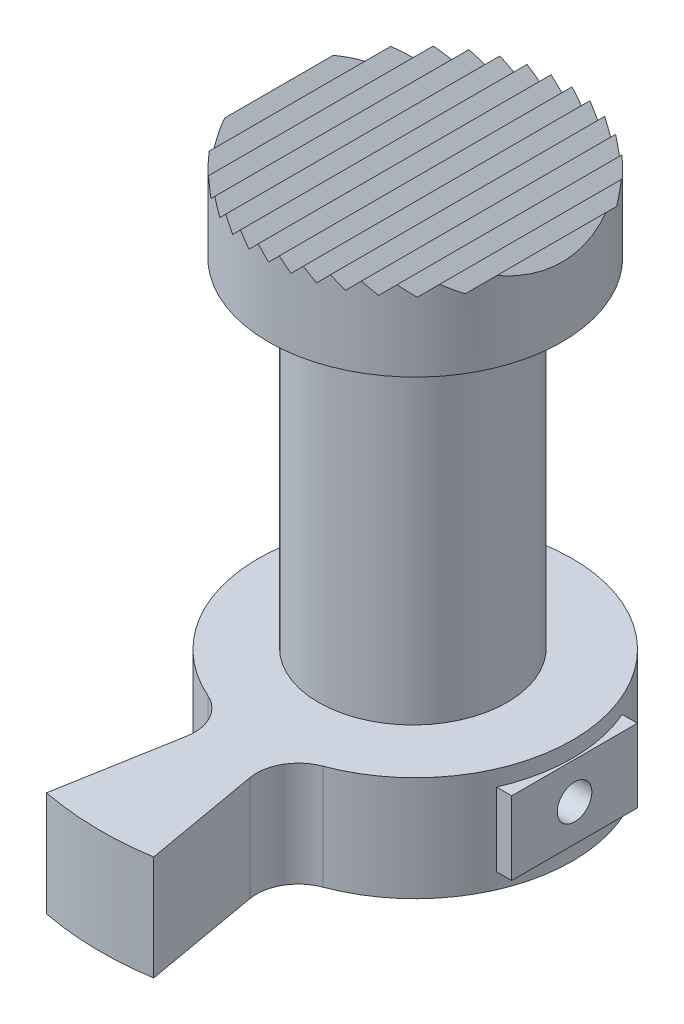
from build123d import *

# Parameters (mm, degrees)
SKETCH1_R                = 7.5
BOSS_EXTRUDE1_DEPTH      = 5
SKETCH2_R                = 7
BOSS_EXTRUDE2_DEPTH      = 20
CUT_EXTRUDE2_DEPTH       = 28.156951228
CUT_EXTRUDE2_DEPTH_BACK  = 28.156951228
SKETCH6_R                = 1.3
CUT_EXTRUDE3_DEPTH       = 0.7
SKETCH9_R                = 0.8
CUT_EXTRUDE4_DEPTH       = 7
BOSS_EXTRUDE3_DEPTH      = 0.1
BOSS_EXTRUDE3_DEPTH_BACK = 1
SKETCH10_W               = 6
SKETCH10_H               = 3.5
SKETCH17_R               = 7.5
SKETCH17_R_2             = 4.5
CUT_EXTRUDE7_DEPTH       = 16.2
BOSS_EXTRUDE6_DEPTH      = 5
FILLET2_R                = 2
SKETCH11_R               = 0.825
CUT_EXTRUDE8_DEPTH       = 7.5


with BuildPart() as part:
    # Sketch1 → Boss-Extrude1 (new body)
    with BuildSketch(Plane(origin=(0, 0, 0), x_dir=(1, 0, 0), z_dir=(0, 1, 0))):
        with Locations(Location((0, 0, 0), (0, 0, 270))):
            Circle(SKETCH1_R)
    extrude(amount=BOSS_EXTRUDE1_DEPTH)

    # Sketch2 → Boss-Extrude2 (add)
    with BuildSketch(Plane(origin=(0, 5, 0), x_dir=(1, 0, 0), z_dir=(0, 1, 0))):
        with Locations(Location((0, 0, 0), (0, 0, 270))):
            Circle(SKETCH2_R)
    extrude(amount=BOSS_EXTRUDE2_DEPTH)

    # Sketch5 → Cut-Extrude2 (cut, two sides: drawn at the far end of the back side and taken through both)
    with BuildSketch(Plane.XY.offset(-CUT_EXTRUDE2_DEPTH_BACK)):
        Polygon((-7.502045815, 25), (-7, 24.497954185), (-6.502045815, 25), (-6, 24.497954185), (-5.502045815, 25), (-5, 24.497954185), (-4.502045815, 25), (-4, 24.497954185), (-3.502045815, 25), (-3, 24.497954185), (-2.502045815, 25), (-2, 24.497954185), (-1.502045815, 25), (-1, 24.497954185), (-0.502045815, 25), (0, 24.497954185), (0.497954185, 25), (1, 24.497954185), (1.497954185, 25), (2, 24.497954185), (2.497954185, 25), (3, 24.497954185), (3.497954185, 25), (4, 24.497954185), (4.497954185, 25), (5, 24.497954185), (5.497954185, 25), (6, 24.497954185), (6.497954185, 25), (7, 24.497954185), (7, 25.505612795), (-7.502045815, 25.505612795), align=None)
    extrude(amount=CUT_EXTRUDE2_DEPTH + CUT_EXTRUDE2_DEPTH_BACK, mode=Mode.SUBTRACT)

    # Sketch6 → Cut-Extrude3 (cut)
    with BuildSketch(Plane.XZ):
        with Locations(Location((0, 0, 0), (0, 0, 270))):
            Circle(SKETCH6_R)
    extrude(amount=-CUT_EXTRUDE3_DEPTH, mode=Mode.SUBTRACT)

    # Sketch9 → Cut-Extrude4 (cut)
    with BuildSketch(Plane.XZ.offset(-0.7)):
        with Locations(Location((0, 0, 0), (0, 0, 270))):
            Circle(SKETCH9_R)
    extrude(amount=-CUT_EXTRUDE4_DEPTH, mode=Mode.SUBTRACT)

    # Sketch10 → Boss-Extrude3 (add, two sides: drawn at the far end of the back side and taken through both)
    with BuildSketch(Plane(origin=(7.5, 0, 0), x_dir=(0, 0, -1), z_dir=(1, 0, 0)).offset(-BOSS_EXTRUDE3_DEPTH_BACK)):
        with Locations((0, 2.5)):
            Rectangle(SKETCH10_W, SKETCH10_H)
    extrude(amount=BOSS_EXTRUDE3_DEPTH + BOSS_EXTRUDE3_DEPTH_BACK)

    # Sketch17 → Cut-Extrude7 (cut)
    with BuildSketch(Plane(origin=(0, 5, 0), x_dir=(1, 0, 0), z_dir=(0, 1, 0))):
        with Locations(Location((0, 0, 0), (0, 0, 270))):
            Circle(SKETCH17_R)
        with Locations(Location((-0.11397387, 0, 0), (0, 0, 270))):
            Circle(SKETCH17_R_2, mode=Mode.SUBTRACT)
    extrude(amount=CUT_EXTRUDE7_DEPTH, mode=Mode.SUBTRACT)

    # Sketch20 → Boss-Extrude6 (add)
    with BuildSketch(Plane.XZ):
        with BuildLine():
            Line((0.70668366, 5.570291045), (2.337095188, 14.816814303))
            ThreePointArc((2.337095188, 14.816814303), (1.03683138, 14.964123118), (-0.271323341, 14.997545921))
            ThreePointArc((-0.271323341, 14.997545921), (-1.577413128, 14.916828343), (-2.871497849, 14.722584695))
            Line((-2.871497849, 14.722584695), (-1.241086321, 5.476061437))
            ThreePointArc((-1.241086321, 5.476061437), (-0.759093411, 5.56339117), (-0.271323341, 5.608380137))
            ThreePointArc((-0.271323341, 5.608380137), (0.218511662, 5.610685945), (0.70668366, 5.570291045))
        make_face()
    extrude(amount=-BOSS_EXTRUDE6_DEPTH)

    # Fillet2
    fillet2_edges = [part.edges().sort_by_distance(p)[0] for p in [
        (1.0343075, 2.5, 7.428338172),
        (-1.568710161, 2.5, 7.334108564),
    ]]
    fillet(fillet2_edges, radius=FILLET2_R)

    # Sketch11 → Cut-Extrude8 (cut)
    with BuildSketch(Plane(origin=(7.6, 0, 0), x_dir=(0, 0, -1), z_dir=(1, 0, 0))):
        with Locations((0, 2.5)):
            Circle(SKETCH11_R)
    extrude(amount=-CUT_EXTRUDE8_DEPTH, mode=Mode.SUBTRACT)


solid = part.part
